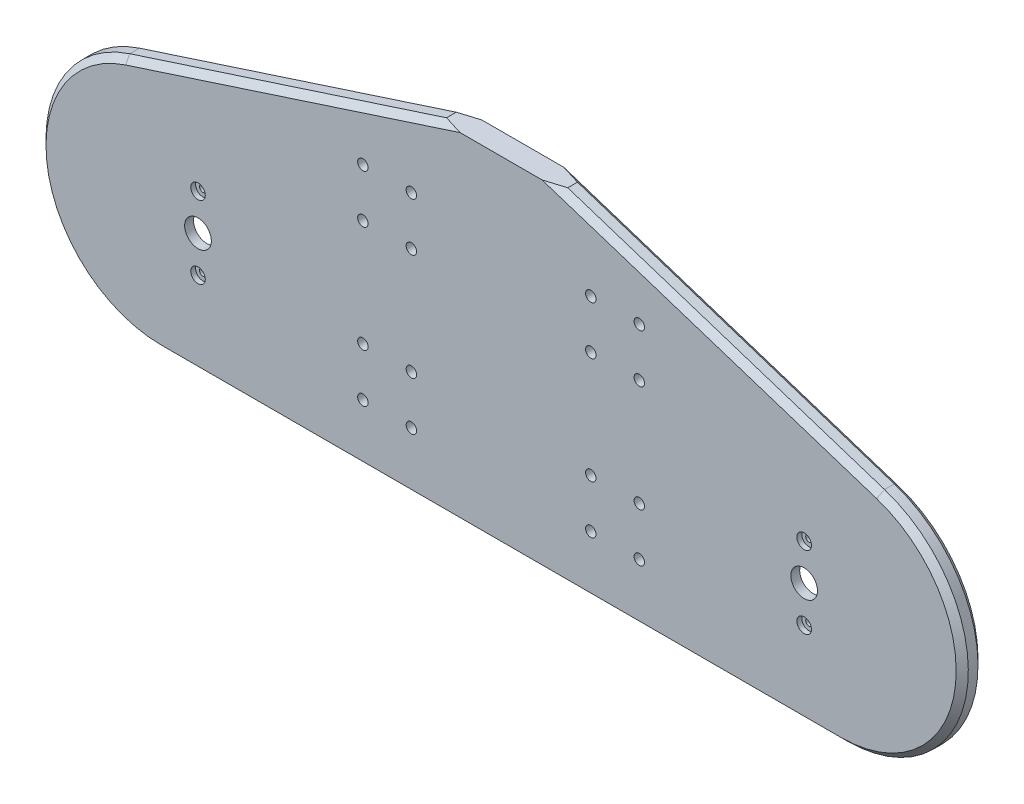
from build123d import *

# Parameters (mm, degrees)
SKETCH_1_R               = 11
EXTRUDE_1_DEPTH          = 8
FILLET_1_R               = 100
FILLET_3_R               = 100
EXTRUDE_2_DEPTH          = 10
FILLET_2_R               = 10
CHAMFER_1_SIZE           = 5
SKETCH_4_R               = 13
CUT_EXTRUDE_1_DEPTH      = 0.7
SKETCH_5_R               = 2.75
CUT_EXTRUDE_2_DEPTH      = 514.540365546
SKETCH_6_R               = 6
CUT_EXTRUDE_3_DEPTH      = 4
CUT_EXTRUDE_4_DEPTH      = 514.758413114
CUT_EXTRUDE_4_DEPTH_BACK = 514.758413114
SKETCH_7_R               = 4.3


with BuildPart() as part:
    # 草图1 → 凸台-拉伸1 (new body)
    with BuildSketch(Plane.XY):
        Polygon((0, 280), (861.751390409, 0), (0, 0), (-100, 0), (-961.751390409, 0), (-100, 280), align=None)
        with Locations((200, 100)):
            Circle(SKETCH_1_R, mode=Mode.SUBTRACT)
        with Locations(Location((-300, 100, 0), (0, 0, 180))):
            Circle(SKETCH_1_R, mode=Mode.SUBTRACT)
    extrude(amount=EXTRUDE_1_DEPTH)

    # 圆角1
    fillet_1_edges = [part.edges().sort_by_distance(p)[0] for p in [
        (861.751390409, 0, 4),
    ]]
    fillet(fillet_1_edges, radius=FILLET_1_R)

    # 圆角3
    fillet_3_edges = [part.edges().sort_by_distance(p)[0] for p in [
        (-961.751390409, 0, 4),
    ]]
    fillet(fillet_3_edges, radius=FILLET_3_R)

    # 草图2 → 凸台-拉伸2 (add)
    with BuildSketch(Plane.XY):
        with BuildLine():
            Line((0, 280), (-100, 280))
            Line((-100, 280), (-361.277938379, 195.10565163))
            ThreePointArc((-361.277938379, 195.10565163), (-429.145073001, 84.356553496), (-330.376238942, 0))
            Line((-330.376238942, 0), (230.376238942, 0))
            ThreePointArc((230.376238942, 0), (329.145073001, 84.356553496), (261.277938379, 195.10565163))
            Line((261.277938379, 195.10565163), (0, 280))
        make_face()
        Polygon((10, 266.236180795), (122.241374643, 229.766747442), (10, 35.358983849), align=None, mode=Mode.SUBTRACT)
        with BuildLine():
            Line((230.376238942, 10), (30, 10))
            Line((30, 10), (151.410485182, 220.289128906))
            Line((151.410485182, 220.289128906), (258.187768435, 185.595086467))
            ThreePointArc((258.187768435, 185.595086467), (319.268189595, 85.920898146), (230.376238942, 10))
        make_face(mode=Mode.SUBTRACT)
        Polygon((-110, 266.236180795), (-110, 35.358983849), (-222.241374643, 229.766747442), align=None, mode=Mode.SUBTRACT)
        with BuildLine():
            Line((-358.187768435, 185.595086467), (-251.410485182, 220.289128906))
            Line((-251.410485182, 220.289128906), (-130, 10))
            Line((-130, 10), (-330.376238942, 10))
            ThreePointArc((-330.376238942, 10), (-419.268189595, 85.920898146), (-358.187768435, 185.595086467))
        make_face(mode=Mode.SUBTRACT)
    extrude(amount=-EXTRUDE_2_DEPTH)

    # 圆角2
    fillet_2_edges = [part.edges().sort_by_distance(p)[0] for p in [
        (-110, 35.358983849, -5),
        (-110, 266.236180795, -5),
        (-130, 10, -5),
        (10, 266.236180795, -5),
        (10, 35.358983849, -5),
        (151.410485182, 220.289128906, -5),
        (30, 10, -5),
        (-251.410485182, 220.289128906, -5),
        (122.241374643, 229.766747442, -5),
        (-222.241374643, 229.766747442, -5),
    ]]
    fillet(fillet_2_edges, radius=FILLET_2_R)

    # 倒角1
    chamfer_1_edges = [part.edges().sort_by_distance(p)[0] for p in [
        (-230.63896919, 237.552825815, 8),
        (130.63896919, 237.552825815, 8),
        (329.145073001, 84.356553496, 8),
        (-50, 0, 8),
        (-429.145073001, 84.356553496, 8),
        (-230.63896919, 237.552825815, -10),
        (130.63896919, 237.552825815, -10),
        (329.145073001, 84.356553496, -10),
        (-50, 0, -10),
        (-429.145073001, 84.356553496, -10),
    ]]
    chamfer(chamfer_1_edges, length=CHAMFER_1_SIZE)

    # 草图4 → 切除-拉伸1 (cut)
    with BuildSketch(Plane(origin=(0, 0, 0), x_dir=(-1, 0, 0), z_dir=(0, 0, -1))):
        with Locations((-200, 100)):
            Circle(SKETCH_4_R)
        with Locations((300, 100)):
            Circle(SKETCH_4_R)
    extrude(amount=-CUT_EXTRUDE_1_DEPTH, mode=Mode.SUBTRACT)

    # 草图5 → 切除-拉伸2 (cut, through all)
    with BuildSketch(Plane(origin=(0, 0, 0), x_dir=(-1, 0, 0), z_dir=(0, 0, -1))):
        with Locations((-200, 130)):
            Circle(SKETCH_5_R)
        with Locations((-200, 70)):
            Circle(SKETCH_5_R)
        with Locations((300, 130)):
            Circle(SKETCH_5_R)
        with Locations((300, 70)):
            Circle(SKETCH_5_R)
    extrude(amount=-CUT_EXTRUDE_2_DEPTH, mode=Mode.SUBTRACT)

    # 草图6 → 切除-拉伸3 (cut)
    with BuildSketch(Plane.XY.offset(8)):
        with Locations((200, 130)):
            Circle(SKETCH_6_R)
        with Locations((200, 70)):
            Circle(SKETCH_6_R)
        with Locations((-300, 130)):
            Circle(SKETCH_6_R)
        with Locations((-300, 70)):
            Circle(SKETCH_6_R)
    extrude(amount=-CUT_EXTRUDE_3_DEPTH, mode=Mode.SUBTRACT)

    # 草图7 → 切除-拉伸4 (cut, two sides: drawn at the far end of the back side and taken through both)
    with BuildSketch(Plane.XY.offset(8).offset(-CUT_EXTRUDE_4_DEPTH_BACK)):
        with Locations((64, 217)):
            Circle(SKETCH_7_R)
        with Locations((24, 217)):
            Circle(SKETCH_7_R)
        with Locations((64, 177)):
            Circle(SKETCH_7_R)
        with Locations((24, 177)):
            Circle(SKETCH_7_R)
        with Locations((64, 89)):
            Circle(SKETCH_7_R)
        with Locations((24, 89)):
            Circle(SKETCH_7_R)
        with Locations((64, 49)):
            Circle(SKETCH_7_R)
        with Locations((24, 49)):
            Circle(SKETCH_7_R)
        with Locations(Location((-124, 49, 0), (0, 0, 180))):
            Circle(SKETCH_7_R)
        with Locations(Location((-164, 49, 0), (0, 0, 180))):
            Circle(SKETCH_7_R)
        with Locations(Location((-124, 89, 0), (0, 0, 180))):
            Circle(SKETCH_7_R)
        with Locations(Location((-164, 89, 0), (0, 0, 180))):
            Circle(SKETCH_7_R)
        with Locations(Location((-124, 177, 0), (0, 0, 180))):
            Circle(SKETCH_7_R)
        with Locations(Location((-164, 177, 0), (0, 0, 180))):
            Circle(SKETCH_7_R)
        with Locations(Location((-124, 217, 0), (0, 0, 180))):
            Circle(SKETCH_7_R)
        with Locations(Location((-164, 217, 0), (0, 0, 180))):
            Circle(SKETCH_7_R)
    extrude(amount=CUT_EXTRUDE_4_DEPTH + CUT_EXTRUDE_4_DEPTH_BACK, mode=Mode.SUBTRACT)


solid = part.part
